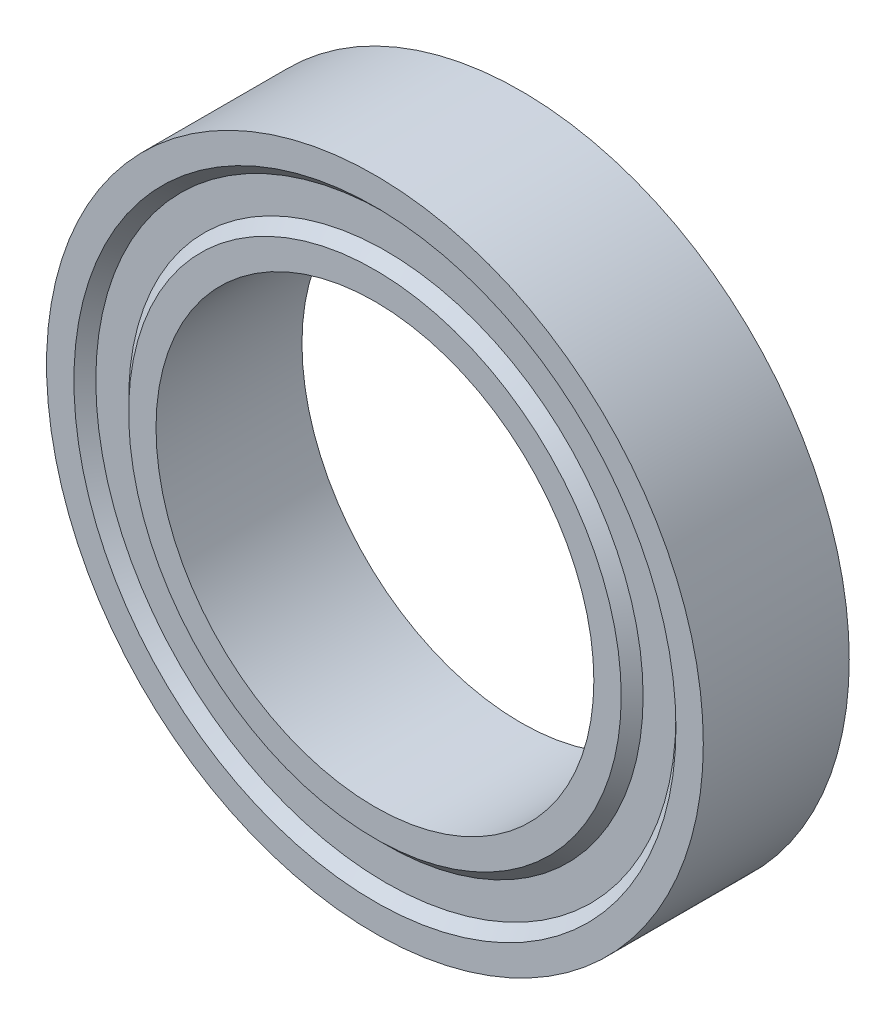
from build123d import *


with BuildPart() as part:
    # Sketch1 → Revolve1 (revolve)
    with BuildSketch(Plane(origin=(0, 0, 0), x_dir=(1, 0, 0), z_dir=(0, 1, 0))):
        Polygon((6, -2), (6, 2), (6.75, 2), (7.05, 1.7), (7.95, 1.7), (8.25, 2), (9, 2), (9, -2), (8.25, -2), (7.95, -1.7), (7.05, -1.7), (6.75, -2), align=None)
    revolve(axis=Axis((0, 0, 0), (0, 0, -1)))


solid = part.part
